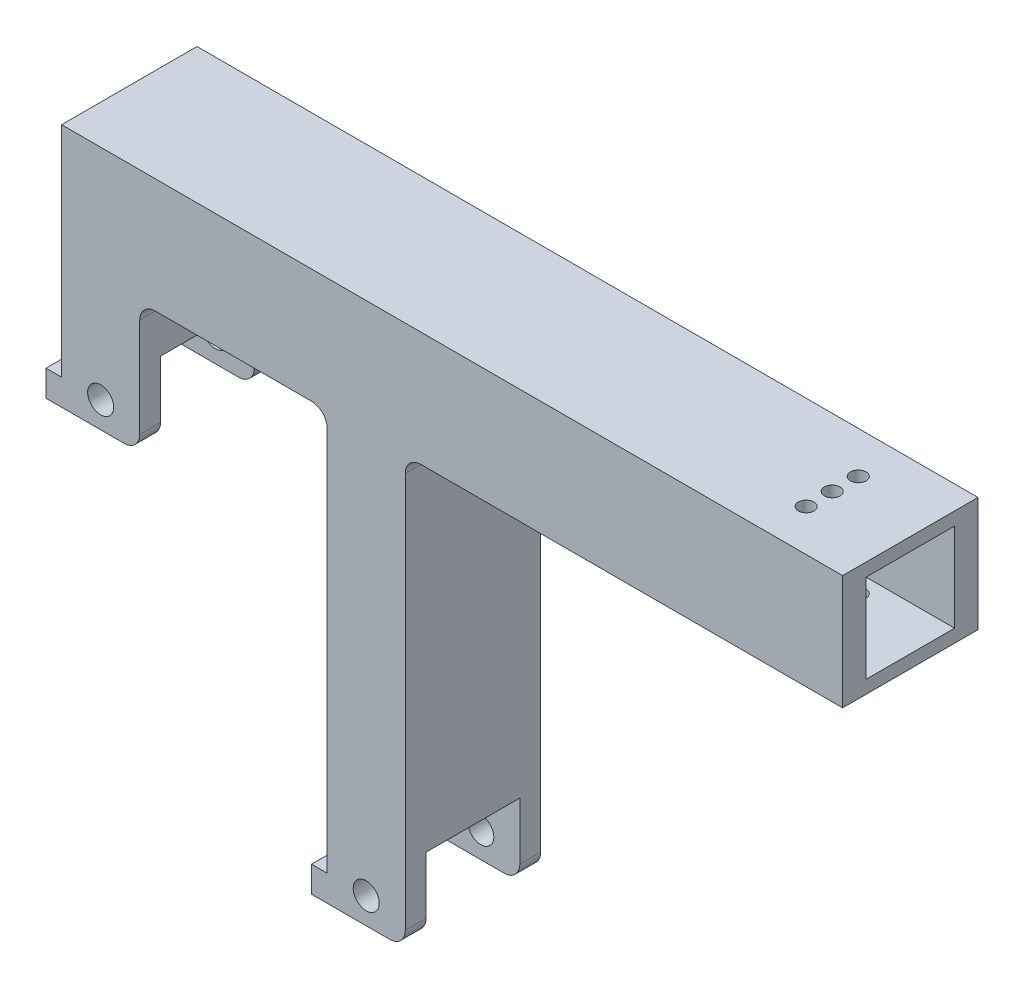
from build123d import *

# Parameters (mm, degrees)
SKETCH_1_R               = 2.5
SKETCH_1_W               = 3
SKETCH_1_H               = 5
EXTRUDE_2_DEPTH          = 26
CUT_EXTRUDE_3_REACH      = 151.57
SKETCH_5_W               = 18
SKETCH_5_H               = 14
CUT_EXTRUDE_5_DEPTH      = 180.392084627
CUT_EXTRUDE_5_DEPTH_BACK = 22
SKETCH_7_R               = 1.5
SKETCH_8_W               = 17
SKETCH_8_H               = 17
CUT_EXTRUDE_6_DEPTH      = 190.681647041
SKETCH_9_W               = 18
SKETCH_9_H               = 14
CUT_EXTRUDE_7_DEPTH      = 15
FILLET_1_R               = 3
FILLET_2_R               = 3
FILLET_3_R               = 3
FILLET_4_R               = 3


with BuildPart() as part:
    # 草图1 → 凸台-拉伸2 (new body)
    # profile 1 of 3: a face of its own
    with BuildSketch(Plane.XY):
        Polygon((8.838520664, 62.0602), (8.838520664, 87.0602), (44.838520664, 87.0602), (44.838520664, 10.0602), (44.838520664, 5.0602), (59.838520664, 5.0602), (59.838520664, 87.0602), (143.838520664, 87.0602), (143.838520664, 109.0602), (-6.161479336, 109.0602), (-6.161479336, 87.0602), (-6.161479336, 67.0602), (-6.161479336, 62.0602), align=None)
        with Locations(Location((52.338520664, 10.0602, 0), (0, 0, 180))):
            Circle(SKETCH_1_R, mode=Mode.SUBTRACT)
        with Locations(Location((1.338520664, 67.0602, 0), (0, 0, 180))):
            Circle(SKETCH_1_R, mode=Mode.SUBTRACT)
    # profile 2 of 3: a face of its own
    with BuildSketch(Plane.XY):
        with Locations((-7.661479336, 64.5602)):
            Rectangle(SKETCH_1_W, SKETCH_1_H)
    # profile 3 of 3: a face of its own
    with BuildSketch(Plane.XY):
        with Locations((43.338520664, 7.5602)):
            Rectangle(SKETCH_1_W, SKETCH_1_H)
    extrude(amount=EXTRUDE_2_DEPTH)

    # 草图5 → 切除-拉伸3 (cut, up to next)
    with BuildSketch(Plane.ZY.offset(-44.838520664), mode=Mode.PRIVATE) as cut_extrude_3_sk1:
        with Locations((13, 12.0602)):
            Rectangle(SKETCH_5_W, SKETCH_5_H)
    cut_extrude_3_tool1 = extrude(cut_extrude_3_sk1.sketch, amount=-CUT_EXTRUDE_3_REACH, mode=Mode.PRIVATE) & part.part
    add(cut_extrude_3_tool1.solids().sort_by_distance((44.838521, 12.0602, 13))[0], mode=Mode.SUBTRACT)

    # 草图7 → 切除-拉伸5 (cut, two sides: drawn at the far end of the back side and taken through both)
    with BuildSketch(Plane(origin=(0, 109.0602, 0), x_dir=(1, 0, 0), z_dir=(0, 1, 0)).offset(-CUT_EXTRUDE_5_DEPTH_BACK)):
        with Locations(Location((128.837370272, -13, 0), (0, 0, 270))):
            Circle(SKETCH_7_R)
        with Locations(Location((128.837370272, -8, 0), (0, 0, 270))):
            Circle(SKETCH_7_R)
        with Locations(Location((128.837370272, -18, 0), (0, 0, 270))):
            Circle(SKETCH_7_R)
    extrude(amount=CUT_EXTRUDE_5_DEPTH + CUT_EXTRUDE_5_DEPTH_BACK, mode=Mode.SUBTRACT)

    # 草图8 → 切除-拉伸6 (cut, through all)
    with BuildSketch(Plane(origin=(143.838520664, 0, 0), x_dir=(0, 0, -1), z_dir=(1, 0, 0))):
        with Locations((-13, 98.0602)):
            Rectangle(SKETCH_8_W, SKETCH_8_H)
    extrude(amount=-CUT_EXTRUDE_6_DEPTH, mode=Mode.SUBTRACT)

    # 草图9 → 切除-拉伸7 (cut)
    with BuildSketch(Plane(origin=(8.838520664, 0, 0), x_dir=(0, 0, -1), z_dir=(1, 0, 0))):
        with Locations((-13, 69.0602)):
            Rectangle(SKETCH_9_W, SKETCH_9_H)
    extrude(amount=-CUT_EXTRUDE_7_DEPTH, mode=Mode.SUBTRACT)

    # 圆角1
    fillet_1_edges = [part.edges().sort_by_distance(p)[0] for p in [
        (59.838520664, 87.0602, 13),
        (8.838520664, 87.0602, 13),
    ]]
    fillet(fillet_1_edges, radius=FILLET_1_R)

    # 圆角2
    fillet_2_edges = [part.edges().sort_by_distance(p)[0] for p in [
        (44.838520664, 87.0602, 13),
    ]]
    fillet(fillet_2_edges, radius=FILLET_2_R)

    # 圆角3
    fillet_3_edges = [part.edges().sort_by_distance(p)[0] for p in [
        (8.838520664, 62.0602, 24),
    ]]
    fillet(fillet_3_edges, radius=FILLET_3_R)

    # 圆角4
    fillet_4_edges = [part.edges().sort_by_distance(p)[0] for p in [
        (8.838520664, 62.0602, 2),
        (59.838520664, 5.0602, 24),
        (59.838520664, 5.0602, 2),
    ]]
    fillet(fillet_4_edges, radius=FILLET_4_R)


solid = part.part
